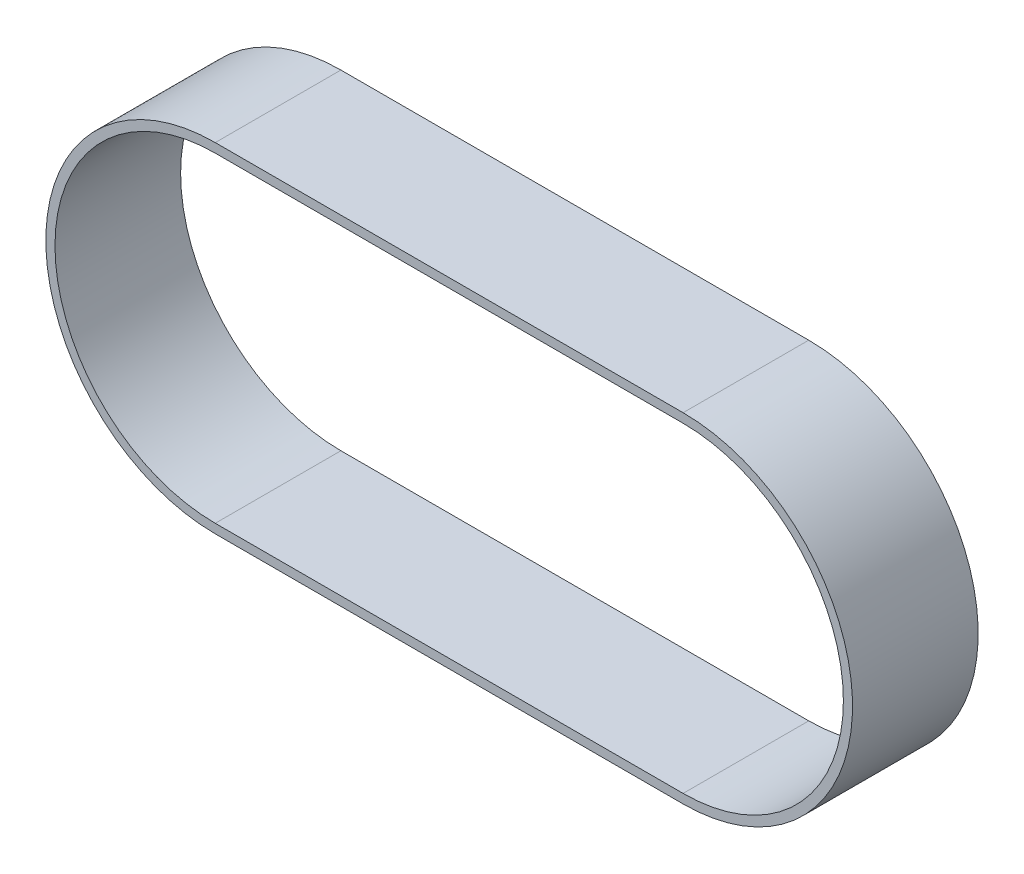
from build123d import *

# Parameters (mm, degrees)
CROQUIS1_W              = 51.2
CROQUIS1_H              = 13.75
SALIENTE_EXTRUIR1_DEPTH = 1
SALIENTE_EXTRUIR2_DEPTH = 13.75
SALIENTE_EXTRUIR3_REACH = 82.173
CROQUIS4_W              = 13.75
CROQUIS4_H              = 1


with BuildPart() as part:
    # Croquis1 → Saliente-Extruir1 (new body)
    with BuildSketch(Plane(origin=(0, 0, 0), x_dir=(1, 0, 0), z_dir=(0, 1, 0))):
        with Locations((0, 6.875)):
            Rectangle(CROQUIS1_W, CROQUIS1_H)
    extrude(amount=SALIENTE_EXTRUIR1_DEPTH)

    # Croquis2 → Saliente-Extruir2 (add)
    with BuildSketch(Plane.XY):
        with BuildLine():
            Line((25.6, 36.08), (25.6, 37.08))
            ThreePointArc((25.6, 37.08), (44.14, 18.54), (25.6, 0))
            Line((25.6, 0), (25.6, 1))
            ThreePointArc((25.6, 1), (43.14, 18.54), (25.6, 36.08))
        make_face()
        with BuildLine():
            ThreePointArc((-25.6, 36.08), (-43.14, 18.54), (-25.6, 1))
            Line((-25.6, 1), (-25.6, 0))
            ThreePointArc((-25.6, 0), (-44.14, 18.54), (-25.6, 37.08))
            Line((-25.6, 37.08), (-25.6, 36.08))
        make_face()
    extrude(amount=-SALIENTE_EXTRUIR2_DEPTH)

    # Saliente-Extruir3: up to this face of the body (flat: up to its plane)
    saliente_extruir3_end = Plane(part.part.faces().sort_by_distance((25.6, 36.58, -6.875))[0])
    # Croquis4 → Saliente-Extruir3 (add, up to the picked face)
    with BuildSketch(Plane(origin=(-25.6, 0, 0), x_dir=(0, 0, -1), z_dir=(1, 0, 0)), mode=Mode.PRIVATE) as saliente_extruir3_sk1:
        with Locations((6.875, 36.58)):
            Rectangle(CROQUIS4_W, CROQUIS4_H)
    saliente_extruir3_tool1 = split(extrude(saliente_extruir3_sk1.sketch, amount=SALIENTE_EXTRUIR3_REACH, mode=Mode.PRIVATE), bisect_by=saliente_extruir3_end, keep=Keep.BOTH, mode=Mode.PRIVATE)
    add(saliente_extruir3_tool1.solids().sort_by(Axis((-25.6, 36.58, -6.875), (1, 0, 0)))[0])


solid = part.part
